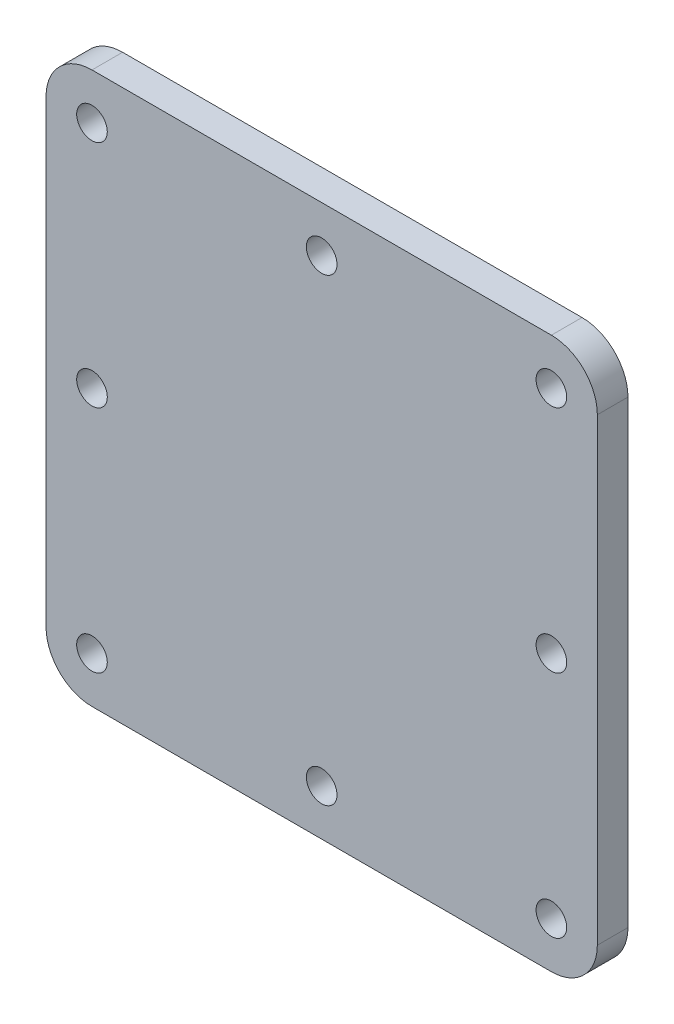
from build123d import *

# Parameters (mm, degrees)
SKETCH2_R           = 5
BOSS_EXTRUDE1_DEPTH = 10


with BuildPart() as part:
    # Sketch2 → Boss-Extrude1 (new body)
    with BuildSketch(Plane.XY):
        with BuildLine():
            Line((-75, 90), (75, 90))
            ThreePointArc((75, 90), (85.606601718, 85.606601718), (90, 75))
            Line((90, 75), (90, -75))
            ThreePointArc((90, -75), (85.606601718, -85.606601718), (75, -90))
            Line((75, -90), (-75, -90))
            ThreePointArc((-75, -90), (-85.606601718, -85.606601718), (-90, -75))
            Line((-90, -75), (-90, 75))
            ThreePointArc((-90, 75), (-85.606601718, 85.606601718), (-75, 90))
        make_face()
        with Locations((-75, 75)):
            Circle(SKETCH2_R, mode=Mode.SUBTRACT)
        with Locations((0, 75)):
            Circle(SKETCH2_R, mode=Mode.SUBTRACT)
        with Locations((75, 75)):
            Circle(SKETCH2_R, mode=Mode.SUBTRACT)
        with Locations((-75, 0)):
            Circle(SKETCH2_R, mode=Mode.SUBTRACT)
        with Locations((75, 0)):
            Circle(SKETCH2_R, mode=Mode.SUBTRACT)
        with Locations((-75, -75)):
            Circle(SKETCH2_R, mode=Mode.SUBTRACT)
        with Locations((0, -75)):
            Circle(SKETCH2_R, mode=Mode.SUBTRACT)
        with Locations((75, -75)):
            Circle(SKETCH2_R, mode=Mode.SUBTRACT)
    extrude(amount=BOSS_EXTRUDE1_DEPTH)


solid = part.part
